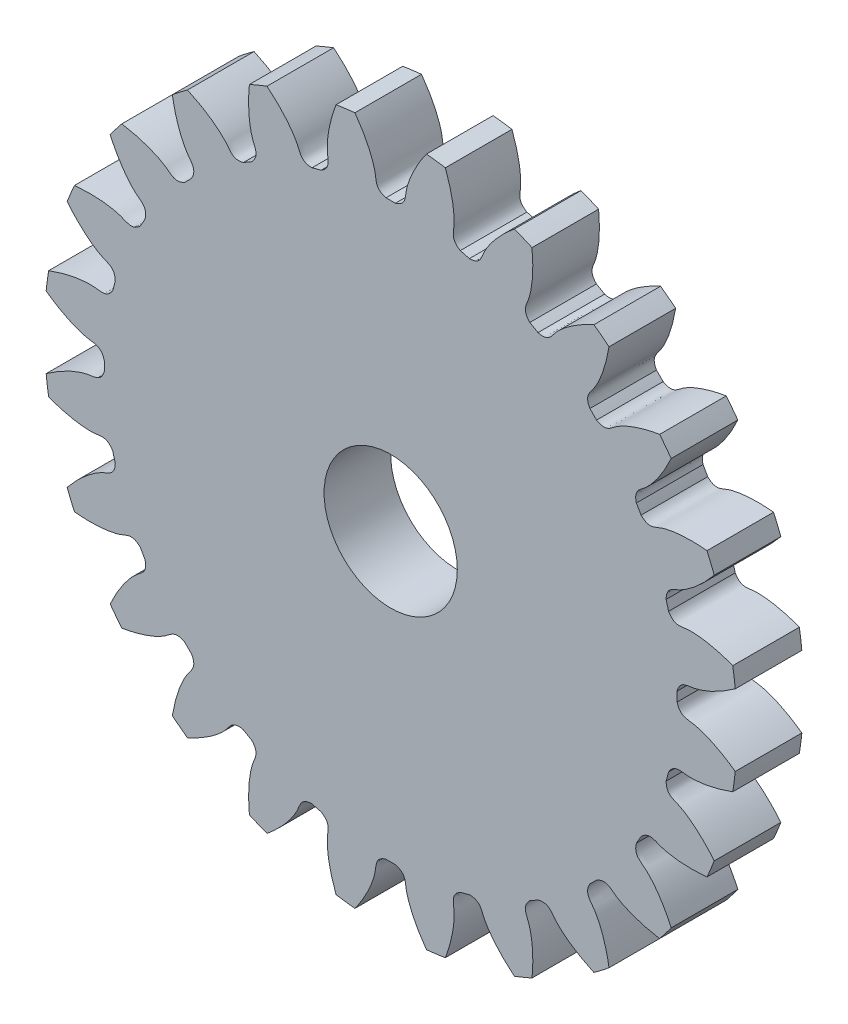
from build123d import *

# Parameters (mm, degrees)
SKETCH_1_R               = 26
EXTRUDE_1_DEPTH          = 2.5
CUT_EXTRUDE_1_DEPTH      = 37.854443423
PATTERN_CIRCULAR_1_COUNT = 24
SKETCH_4_R               = 5
CUT_EXTRUDE_2_DEPTH      = 10


with BuildPart() as part:
    # 草图1 → 凸台-拉伸1 (new, symmetric)
    with BuildSketch(Plane.XY):
        Circle(SKETCH_1_R)
    extrude(amount=EXTRUDE_1_DEPTH, both=True)

    # 草图2 → 切除-拉伸1 (cut, symmetric)
    with BuildSketch(Plane.XY):
        with BuildLine():
            ThreePointArc((0.353663825, 21.49709101), (0, 21.5), (-0.353663825, 21.49709101))
            add(Edge.make_bspline(
                [(-0.353663825, 21.49709101), (-1.135824432, 21.713720144), (-1.078095532, 22.231447194), (-1.172554353, 22.745368905), (-1.186071835, 22.811666085), (-1.202896967, 22.88648029), (-1.223361215, 22.96970543), (-1.247811268, 23.061221345), (-1.276584597, 23.160898741), (-1.310016843, 23.268597737), (-1.348439156, 23.384168443), (-1.392178653, 23.507450915), (-1.441557936, 23.638275308), (-1.496894885, 23.77646198), (-1.558502379, 23.92182162), (-1.626688044, 24.074155372), (-1.701753995, 24.233254975), (-1.783996581, 24.398902904), (-1.873706139, 24.570872518), (-1.971166747, 24.748928215), (-2.076655981, 24.932825595), (-2.190444683, 25.122311622), (-2.312796719, 25.317124804), (-2.443968757, 25.516995365), (-2.584210038, 25.721645435), (-2.733762158, 25.930789236), (-2.89285885, 26.144133282), (-3.061725774, 26.361376576), (-3.240580312, 26.582210822), (-3.429631368, 26.806320631), (-3.629079167, 27.033383741), (-3.83911507, 27.263071241), (-4.059921389, 27.495047793), (-4.291671202, 27.728971868), (-4.534528186, 27.964495978), (-4.788646443, 28.20126692), (-5.054170354, 28.438926019), (-5.331234348, 28.677109382), (-5.720844186, 28.998723112), (-6.023847611, 29.233756636), (-6.23123904, 29.388235858)],
                knots=[0, 0, 0, 0, 0.143961355, 0.149818462, 0.156576662, 0.164235955, 0.172796342, 0.182257821, 0.192620395, 0.203884061, 0.216048821, 0.229114674, 0.24308162, 0.25794966, 0.273718793, 0.290389019, 0.307960339, 0.326432751, 0.345806258, 0.366080857, 0.38725655, 0.409333336, 0.432311215, 0.456190188, 0.480970254, 0.506651413, 0.533233666, 0.560717012, 0.589101451, 0.618386984, 0.64857361, 0.679661329, 0.711650141, 0.744540047, 0.778331046, 0.813023138, 0.848616324, 0.885110603, 0.922505975, 1, 1, 1, 1], degree=3))
            ThreePointArc((-6.23123904, 29.388235858), (0, 30.041583627), (6.23123904, 29.388235858))
            add(Edge.make_bspline(
                [(0.353663825, 21.49709101), (1.135824432, 21.713720144), (1.078095532, 22.231447194), (1.172554353, 22.745368905), (1.186071835, 22.811666085), (1.202896967, 22.88648029), (1.223361215, 22.96970543), (1.247811268, 23.061221345), (1.276584597, 23.160898741), (1.310016843, 23.268597737), (1.348439156, 23.384168443), (1.392178653, 23.507450915), (1.441557936, 23.638275308), (1.496894885, 23.77646198), (1.558502379, 23.92182162), (1.626688044, 24.074155372), (1.701753995, 24.233254975), (1.783996581, 24.398902904), (1.873706139, 24.570872518), (1.971166747, 24.748928215), (2.076655981, 24.932825595), (2.190444683, 25.122311622), (2.312796719, 25.317124804), (2.443968757, 25.516995365), (2.584210038, 25.721645435), (2.733762158, 25.930789236), (2.89285885, 26.144133282), (3.061725774, 26.361376576), (3.240580312, 26.582210822), (3.429631368, 26.806320631), (3.629079167, 27.033383741), (3.83911507, 27.263071241), (4.059921389, 27.495047793), (4.291671202, 27.728971868), (4.534528186, 27.964495978), (4.788646443, 28.20126692), (5.054170354, 28.438926019), (5.331234348, 28.677109382), (5.720844186, 28.998723112), (6.023847611, 29.233756636), (6.23123904, 29.388235858)],
                knots=[0, 0, 0, 0, 0.143961355, 0.149818462, 0.156576662, 0.164235955, 0.172796342, 0.182257821, 0.192620395, 0.203884061, 0.216048821, 0.229114674, 0.24308162, 0.25794966, 0.273718793, 0.290389019, 0.307960339, 0.326432751, 0.345806258, 0.366080857, 0.38725655, 0.409333336, 0.432311215, 0.456190188, 0.480970254, 0.506651413, 0.533233666, 0.560717012, 0.589101451, 0.618386984, 0.64857361, 0.679661329, 0.711650141, 0.744540047, 0.778331046, 0.813023138, 0.848616324, 0.885110603, 0.922505975, 1, 1, 1, 1], degree=3))
        make_face()
    cut_extrude_1 = extrude(amount=CUT_EXTRUDE_1_DEPTH, both=True, mode=Mode.SUBTRACT)

    # 阵列(圆周)1: 切除-拉伸1 ×24 about axis
    pattern_circular_1_axis = Axis((0, 0, -0.25), (0, 0, 1))
    for i in range(1, PATTERN_CIRCULAR_1_COUNT):
        add(cut_extrude_1.rotate(pattern_circular_1_axis, i * 360 / PATTERN_CIRCULAR_1_COUNT), mode=Mode.SUBTRACT)

    # 草图4 → 切除-拉伸2 (cut)
    with BuildSketch(Plane.XY.offset(2.5)):
        Circle(SKETCH_4_R)
    extrude(amount=-CUT_EXTRUDE_2_DEPTH, mode=Mode.SUBTRACT)


solid = part.part
